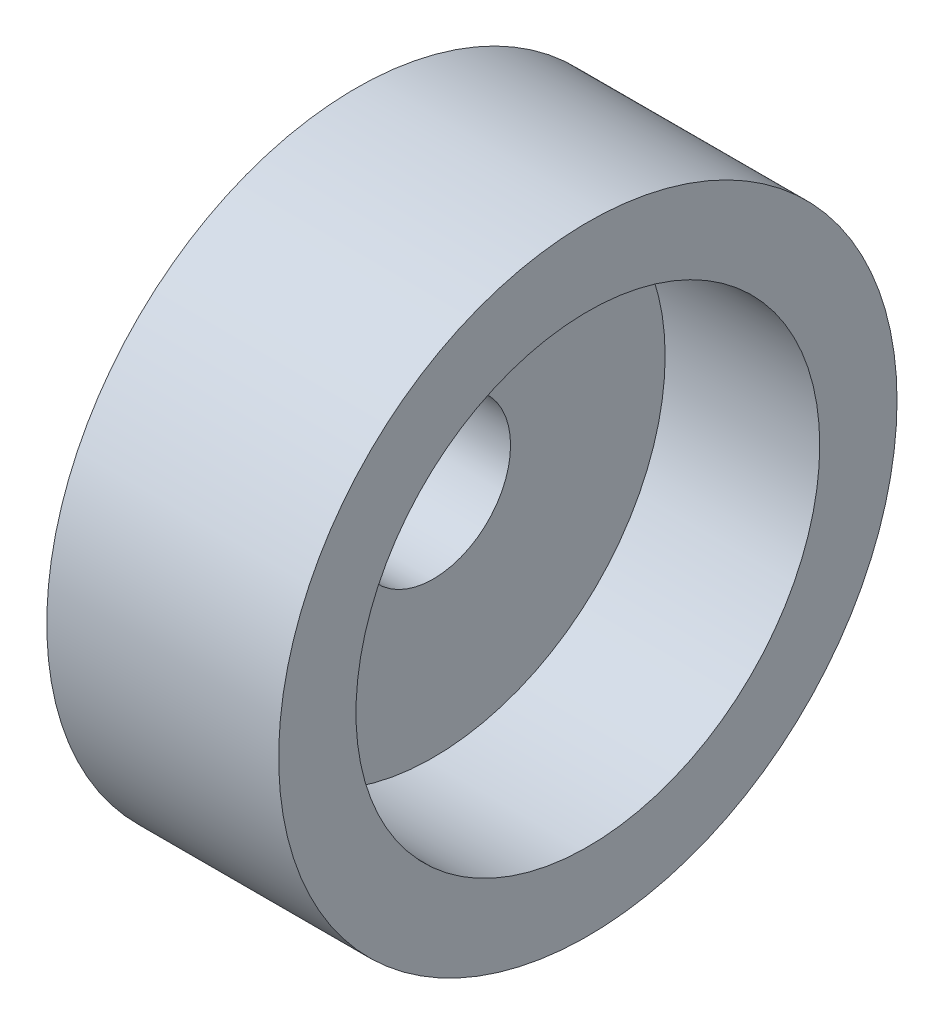
from build123d import *

# Parameters (mm, degrees)
ESBO_O1_R                = 4
RESSALTO_EXTRUS_O1_DEPTH = 3
ESBO_O2_R                = 3
CORTE_EXTRUS_O1_DEPTH    = 2
ESBO_O3_R                = 2.5
RESSALTO_EXTRUS_O2_DEPTH = 1
ESBO_O4_R                = 1
CORTE_EXTRUS_O2_DEPTH    = 7.92820323


with BuildPart() as part:
    # Esboço1 → Ressalto-extrusão1 (new body)
    with BuildSketch(Plane(origin=(0, 0, 0), x_dir=(0, 0, -1), z_dir=(1, 0, 0))):
        Circle(ESBO_O1_R)
    extrude(amount=RESSALTO_EXTRUS_O1_DEPTH)

    # Esboço2 → Corte-extrusão1 (cut)
    with BuildSketch(Plane(origin=(3, 0, 0), x_dir=(0, 0, -1), z_dir=(1, 0, 0))):
        Circle(ESBO_O2_R)
    extrude(amount=-CORTE_EXTRUS_O1_DEPTH, mode=Mode.SUBTRACT)

    # Esboço3 → Ressalto-extrusão2 (add)
    with BuildSketch(Plane.ZY):
        Circle(ESBO_O3_R)
    extrude(amount=RESSALTO_EXTRUS_O2_DEPTH)

    # Esboço4 → Corte-extrusão2 (cut, through all)
    with BuildSketch(Plane.ZY.offset(1)):
        Circle(ESBO_O4_R)
    extrude(amount=-CORTE_EXTRUS_O2_DEPTH, mode=Mode.SUBTRACT)


solid = part.part
